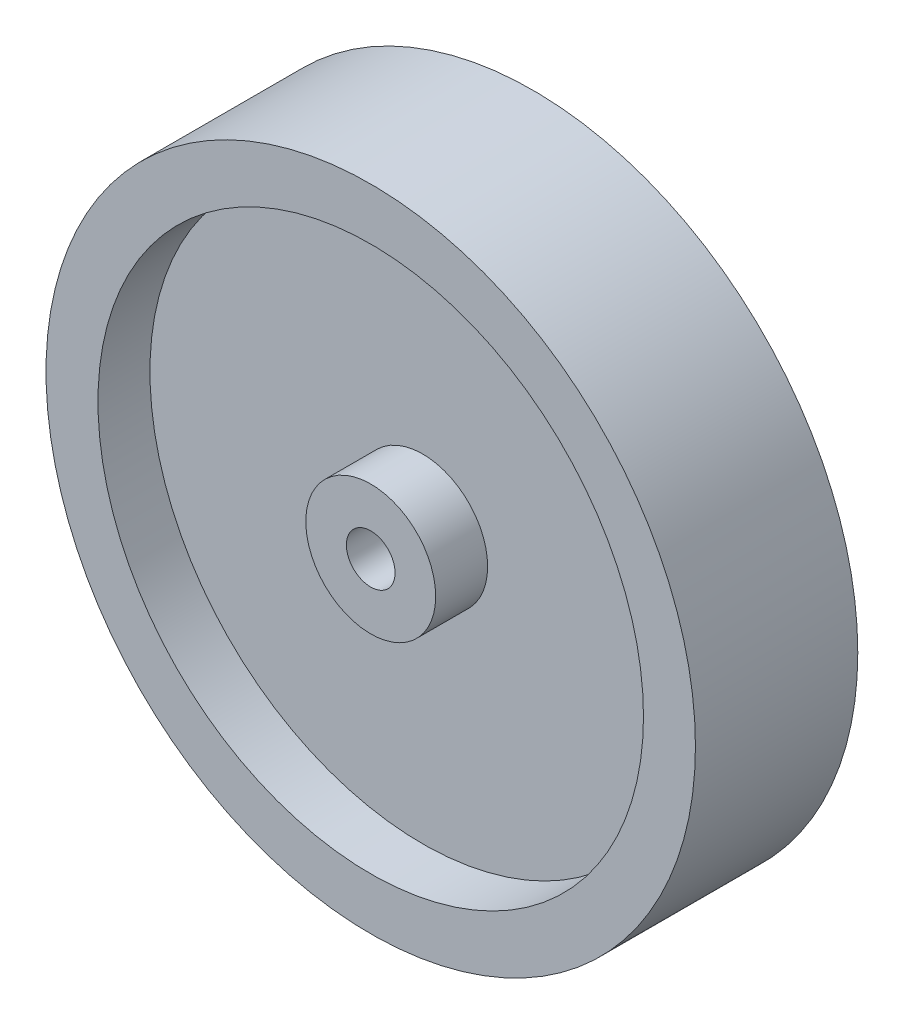
from build123d import *

# Parameters (mm, degrees)
SKETCH1_R           = 63.5
SKETCH1_R_2         = 4.7625
BOSS_EXTRUDE1_DEPTH = 15.875
SKETCH2_R           = 53.34
SKETCH2_R_2         = 12.7
CUT_EXTRUDE1_DEPTH  = 10.16


with BuildPart() as part:
    # Sketch1 → Boss-Extrude1 (new, symmetric)
    with BuildSketch(Plane.XY):
        Circle(SKETCH1_R)
        Circle(SKETCH1_R_2, mode=Mode.SUBTRACT)
    extrude(amount=BOSS_EXTRUDE1_DEPTH, both=True)

    # Sketch2 → Cut-Extrude1 (cut)
    with BuildSketch(Plane.XY.offset(15.875)):
        Circle(SKETCH2_R)
        Circle(SKETCH2_R_2, mode=Mode.SUBTRACT)
    cut_extrude1 = extrude(amount=-CUT_EXTRUDE1_DEPTH, mode=Mode.SUBTRACT)

    # Mirror1: Cut-Extrude1 across plane
    add(cut_extrude1.mirror(Plane.XY), mode=Mode.SUBTRACT)


solid = part.part
